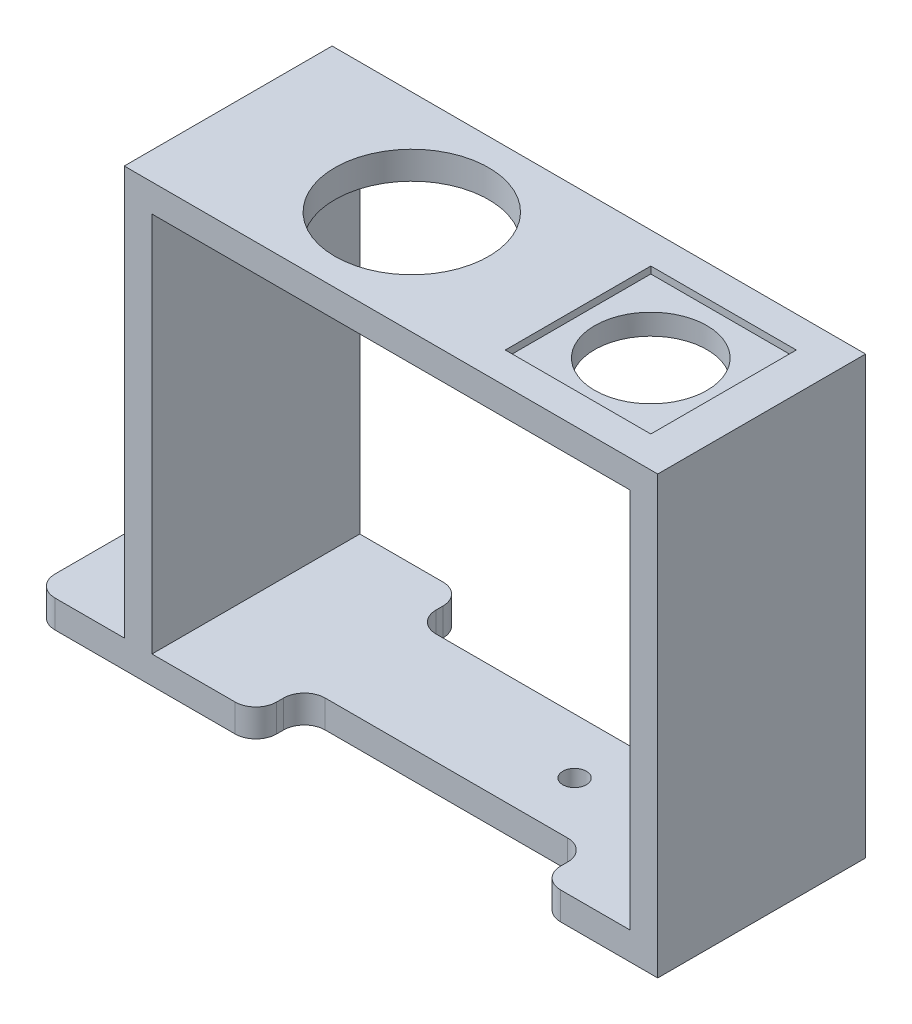
from build123d import *

# Parameters (mm, degrees)
SKETCH_1_W          = 90
SKETCH_1_H          = 30
SKETCH_1_R          = 1.7
EXTRUDE_1_DEPTH     = 4
SKETCH_2_W          = 4
SKETCH_2_H          = 30
EXTRUDE_2_DEPTH     = 55
SKETCH_3_W          = 77
SKETCH_3_H          = 30
SKETCH_3_R          = 11.1
EXTRUDE_3_DEPTH     = 4
SKETCH_4_R          = 8.1
CUT_EXTRUDE_1_DEPTH = 4
SKETCH_5_W          = 21
SKETCH_5_H          = 21
CUT_EXTRUDE_2_DEPTH = 1
SKETCH_6_R          = 1.7
CUT_EXTRUDE_3_DEPTH = 5
SKETCH_7_W          = 41
SKETCH_7_H          = 7
CUT_EXTRUDE_4_DEPTH = 10
FILLET_1_R          = 3


with BuildPart() as part:
    # 草图1 → 凸台-拉伸1 (new body)
    with BuildSketch(Plane(origin=(0, 0, 0), x_dir=(1, 0, 0), z_dir=(0, 1, 0))):
        Rectangle(SKETCH_1_W, SKETCH_1_H)
        with Locations(Location((-40, 0, 0), (0, 0, 270))):
            Circle(SKETCH_1_R, mode=Mode.SUBTRACT)
    extrude(amount=EXTRUDE_1_DEPTH)

    # 草图2 → 凸台-拉伸2 (add)
    with BuildSketch(Plane(origin=(0, 4, 0), x_dir=(1, 0, 0), z_dir=(0, 1, 0))):
        with Locations((-30, 0)):
            Rectangle(SKETCH_2_W, SKETCH_2_H)
        with Locations((43, 0)):
            Rectangle(SKETCH_2_W, SKETCH_2_H)
    extrude(amount=EXTRUDE_2_DEPTH)

    # 草图3 → 凸台-拉伸3 (add)
    with BuildSketch(Plane(origin=(0, 59, 0), x_dir=(1, 0, 0), z_dir=(0, 1, 0))):
        with Locations((6.5, 0)):
            Rectangle(SKETCH_3_W, SKETCH_3_H)
        with Locations(Location((-5.5, 0, 0), (0, 0, 270))):
            Circle(SKETCH_3_R, mode=Mode.SUBTRACT)
    extrude(amount=EXTRUDE_3_DEPTH)

    # 草图4 → 切除-拉伸1 (cut)
    with BuildSketch(Plane(origin=(0, 63, 0), x_dir=(1, 0, 0), z_dir=(0, 1, 0))):
        with Locations(Location((29, 0, 0), (0, 0, 270))):
            Circle(SKETCH_4_R)
    extrude(amount=-CUT_EXTRUDE_1_DEPTH, mode=Mode.SUBTRACT)

    # 草图5 → 切除-拉伸2 (cut)
    with BuildSketch(Plane(origin=(0, 63, 0), x_dir=(1, 0, 0), z_dir=(0, 1, 0))):
        with Locations((29, 0)):
            Rectangle(SKETCH_5_W, SKETCH_5_H)
    extrude(amount=-CUT_EXTRUDE_2_DEPTH, mode=Mode.SUBTRACT)

    # 草图6 → 切除-拉伸3 (cut)
    with BuildSketch(Plane(origin=(0, 4, 0), x_dir=(1, 0, 0), z_dir=(0, 1, 0))):
        with Locations(Location((18, 0, 0), (0, 0, 270))):
            Circle(SKETCH_6_R)
    extrude(amount=-CUT_EXTRUDE_3_DEPTH, mode=Mode.SUBTRACT)

    # 草图7 → 切除-拉伸4 (cut)
    with BuildSketch(Plane(origin=(0, 4, 0), x_dir=(1, 0, 0), z_dir=(0, 1, 0))):
        with Locations((7.5, -11.5)):
            Rectangle(SKETCH_7_W, SKETCH_7_H)
        with Locations((7.5, 11.5)):
            Rectangle(SKETCH_7_W, SKETCH_7_H)
    extrude(amount=-CUT_EXTRUDE_4_DEPTH, mode=Mode.SUBTRACT)

    # 圆角1
    fillet_1_edges = [part.edges().sort_by_distance(p)[0] for p in [
        (28, 2, -8),
        (-13, 2, -8),
        (-45, 2, 15),
        (-45, 2, -15),
        (28, 2, 15),
        (-13, 2, 15),
        (-13, 2, -15),
        (28, 2, -15),
        (-13, 2, 8),
        (28, 2, 8),
    ]]
    fillet(fillet_1_edges, radius=FILLET_1_R)


solid = part.part
